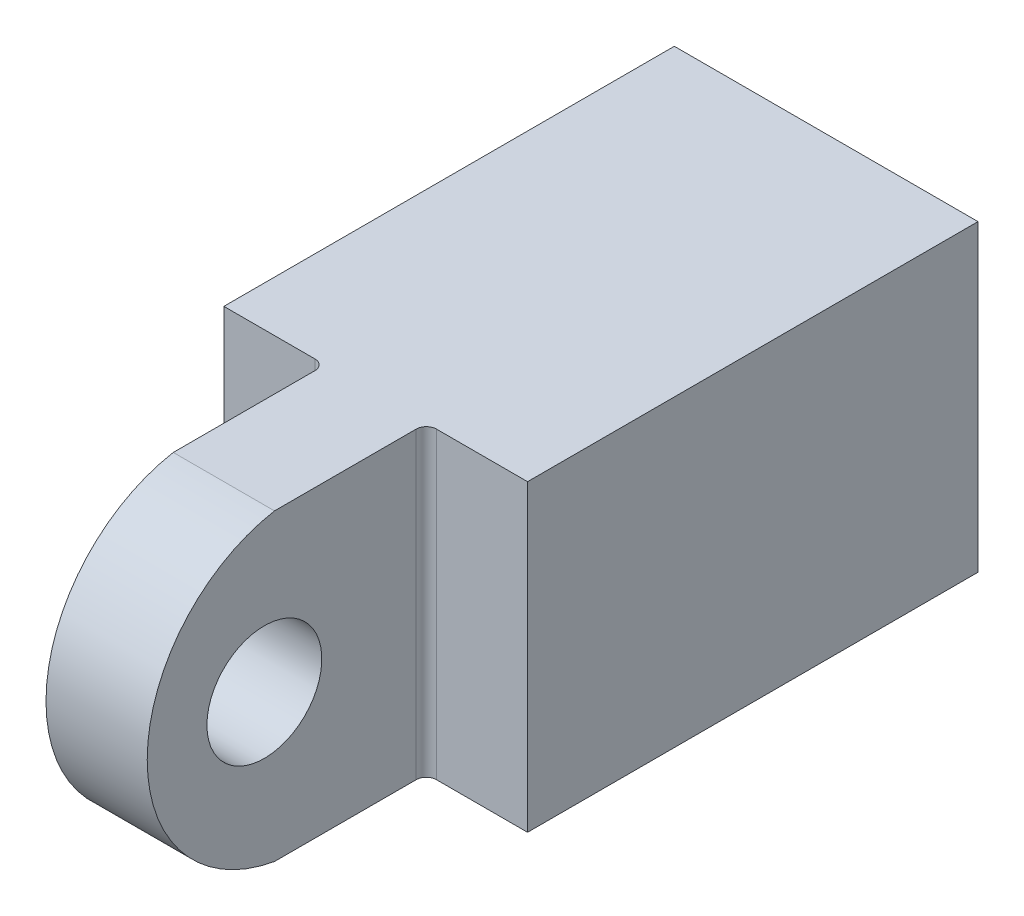
from build123d import *

# Parameters (mm, degrees)
SKETCH2_W           = 60
SKETCH2_H           = 60
BOSS_EXTRUDE1_DEPTH = 89
SKETCH3_W           = 20
SKETCH3_H           = 60
BOSS_EXTRUDE2_DEPTH = 30
BOSS_EXTRUDE3_DEPTH = 20
FILLET1_R           = 2
SKETCH7_W           = 50
SKETCH7_H           = 50
CUT_EXTRUDE1_DEPTH  = 81
SKETCH8_R           = 11.35
CUT_EXTRUDE2_DEPTH  = 153.570263572


with BuildPart() as part:
    # Sketch2 → Boss-Extrude1 (new body)
    with BuildSketch(Plane.XY):
        Rectangle(SKETCH2_W, SKETCH2_H)
    extrude(amount=BOSS_EXTRUDE1_DEPTH)

    # Sketch3 → Boss-Extrude2 (add)
    with BuildSketch(Plane.XY.offset(89)):
        Rectangle(SKETCH3_W, SKETCH3_H)
    extrude(amount=BOSS_EXTRUDE2_DEPTH)

    # Sketch4 → Boss-Extrude3 (add)
    with BuildSketch(Plane(origin=(10, 0, 0), x_dir=(0, 0, -1), z_dir=(1, 0, 0))):
        with BuildLine():
            Line((-119, -30), (-119, 30))
            ThreePointArc((-119, 30), (-144.144668047, 0), (-119, -30))
        make_face()
    extrude(amount=-BOSS_EXTRUDE3_DEPTH)

    # Fillet1
    fillet1_edges = [part.edges().sort_by_distance(p)[0] for p in [
        (-10, 0, 89),
        (10, 0, 89),
    ]]
    fillet(fillet1_edges, radius=FILLET1_R)

    # Sketch7 → Cut-Extrude1 (cut)
    with BuildSketch(Plane(origin=(0, 0, 0), x_dir=(-1, 0, 0), z_dir=(0, 0, -1))):
        Rectangle(SKETCH7_W, SKETCH7_H)
    extrude(amount=-CUT_EXTRUDE1_DEPTH, mode=Mode.SUBTRACT)

    # Sketch8 → Cut-Extrude2 (cut, through all)
    with BuildSketch(Plane.ZY.offset(10)):
        with Locations((121, 0)):
            Circle(SKETCH8_R)
    extrude(amount=-CUT_EXTRUDE2_DEPTH, mode=Mode.SUBTRACT)


solid = part.part
